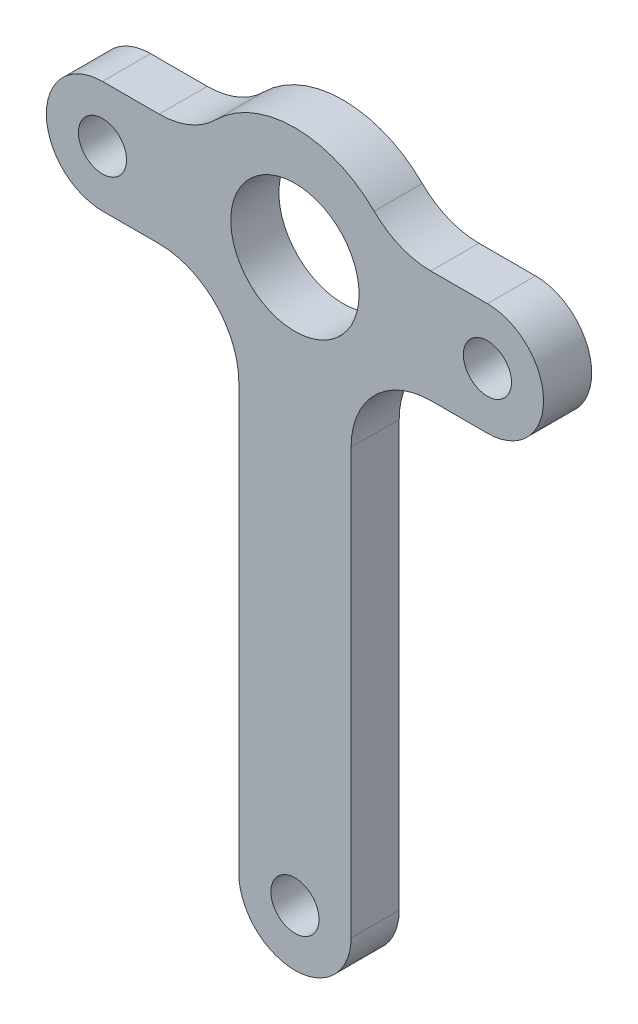
from build123d import *

# Parameters (mm, degrees)
SKETCH_1_R      = 4
SKETCH_1_R_2    = 1.5
EXTRUDE_1_DEPTH = 3


with BuildPart() as part:
    # 草图1 → 凸台-拉伸1 (new body)
    with BuildSketch(Plane.XY):
        with BuildLine():
            Line((-12, -3.5), (-8.5, -3.5))
            ThreePointArc((-8.5, -3.5), (-4.964466094, -4.964466094), (-3.5, -8.5))
            Line((-3.5, -8.5), (-3.5, -35))
            ThreePointArc((-3.5, -35), (0, -38.5), (3.5, -35))
            Line((3.5, -35), (3.5, -8.5))
            ThreePointArc((3.5, -8.5), (4.964466094, -4.964466094), (8.5, -3.5))
            Line((8.5, -3.5), (12, -3.5))
            ThreePointArc((12, -3.5), (15.5, 0), (12, 3.5))
            Line((12, 3.5), (8.470537173, 3.5))
            ThreePointArc((8.470537173, 3.5), (6.561130633, 3.878943122), (4.941146684, 4.958333333))
            ThreePointArc((4.941146684, 4.958333333), (0, 7), (-4.941146684, 4.958333333))
            ThreePointArc((-4.941146684, 4.958333333), (-6.561130633, 3.878943122), (-8.470537173, 3.5))
            Line((-8.470537173, 3.5), (-12, 3.5))
            ThreePointArc((-12, 3.5), (-15.5, 0), (-12, -3.5))
        make_face()
        Circle(SKETCH_1_R, mode=Mode.SUBTRACT)
        with Locations((-12, 0)):
            Circle(SKETCH_1_R_2, mode=Mode.SUBTRACT)
        with Locations((0, -35)):
            Circle(SKETCH_1_R_2, mode=Mode.SUBTRACT)
        with Locations((12, 0)):
            Circle(SKETCH_1_R_2, mode=Mode.SUBTRACT)
    extrude(amount=EXTRUDE_1_DEPTH)


solid = part.part
